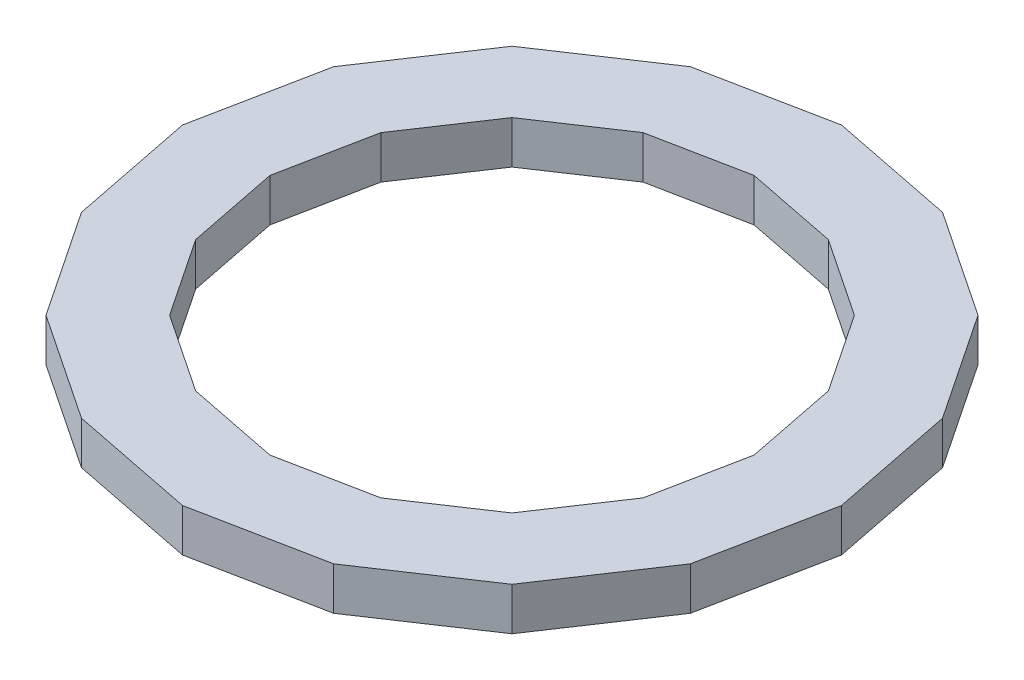
from build123d import *

# Parameters (mm, degrees)
BOSS_EXTRUDE1_DEPTH = 19.05


with BuildPart() as part:
    # Sketch1 → Boss-Extrude1 (new body)
    with BuildSketch(Plane(origin=(0, 0, 0), x_dir=(1, 0, 0), z_dir=(0, 1, 0))):
        Polygon((146.470617838, 0), (135.321205935, 56.051878775), (103.570367118, 103.570367118), (56.051878775, 135.321205935), (0, 146.470617838), (-56.051878775, 135.321205935), (-103.570367118, 103.570367118), (-135.321205935, 56.051878775), (-146.470617838, 0), (-135.321205935, -56.051878775), (-103.570367118, -103.570367118), (-56.051878775, -135.321205935), (0, -146.470617838), (56.051878775, -135.321205935), (103.570367118, -103.570367118), (135.321205935, -56.051878775), align=None)
        Polygon((107.624194711, 0), (99.431790696, 41.185996237), (76.1017979, 76.1017979), (41.185996237, 99.431790696), (0, 107.624194711), (-41.185996237, 99.431790696), (-76.1017979, 76.1017979), (-99.431790696, 41.185996237), (-107.624194711, 0), (-99.431790696, -41.185996237), (-76.1017979, -76.1017979), (-41.185996237, -99.431790696), (0, -107.624194711), (41.185996237, -99.431790696), (76.1017979, -76.1017979), (99.431790696, -41.185996237), align=None, mode=Mode.SUBTRACT)
    extrude(amount=BOSS_EXTRUDE1_DEPTH)


solid = part.part
